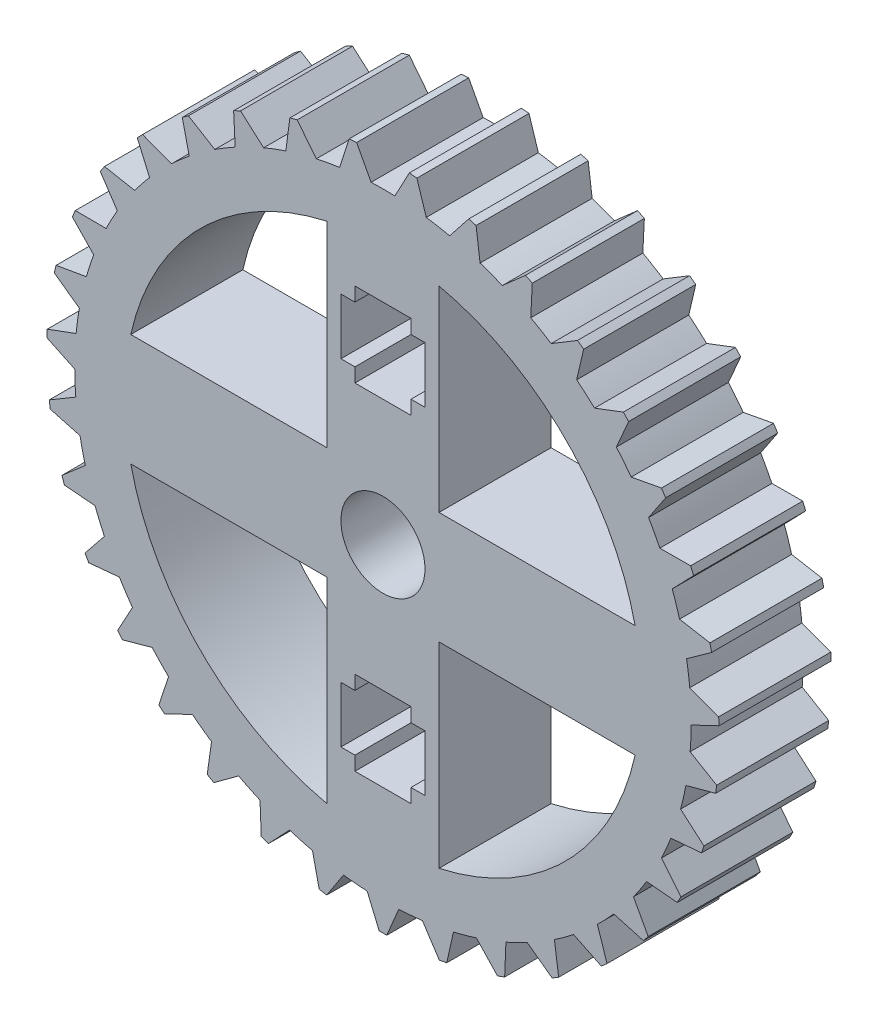
from build123d import *

# Parameters (mm, degrees)
SKETCH1_R            = 6
BOSS_EXTRUDE1_DEPTH  = 2
CUT_EXTRUDE1_DEPTH   = 2
MIRROR2_COPY_1_DEPTH = 2
SKETCH3_R            = 0.75
CUT_EXTRUDE5_DEPTH   = 2
CUT_EXTRUDE6_DEPTH   = 2
CUT_EXTRUDE8_START   = -2
CUT_EXTRUDE8_DEPTH   = 2
CIRPATTERN2_COUNT    = 35


with BuildPart() as part:
    # Sketch1 → Boss-Extrude1 (new body)
    with BuildSketch(Plane.XY):
        Circle(SKETCH1_R)
    extrude(amount=BOSS_EXTRUDE1_DEPTH)

    # Sketch2 → Cut-Extrude1 (cut)
    with BuildSketch(Plane.XY.offset(2)):
        with BuildLine():
            Line((-1, 1), (-4.5, 1))
            ThreePointArc((-4.5, 1), (-3.259601203, 3.259601203), (-1, 4.5))
            Line((-1, 4.5), (-1, 1))
        make_face()
    cut_extrude1 = extrude(amount=-CUT_EXTRUDE1_DEPTH, mode=Mode.SUBTRACT)

    # Mirror1: Cut-Extrude1 across plane
    add(cut_extrude1.mirror(Plane(origin=(0, 0, 0), x_dir=(0, 0, 1), z_dir=(1, 0, 0))), mode=Mode.SUBTRACT)

    # Mirror2: Cut-Extrude1 across plane
    add(cut_extrude1.mirror(Plane.ZX), mode=Mode.SUBTRACT)

    # Mirror2 copy 1 sketch → Mirror2 copy 1 (cut)
    with BuildSketch(Plane(origin=(0, 0, 2), x_dir=(-1, 0, 0), z_dir=(0, 0, 1))):
        with BuildLine():
            Line((-1, 1), (-4.5, 1))
            ThreePointArc((-4.5, 1), (-3.259601203, 3.259601203), (-1, 4.5))
            Line((-1, 4.5), (-1, 1))
        make_face()
    extrude(amount=-MIRROR2_COPY_1_DEPTH, mode=Mode.SUBTRACT)

    # Sketch3 → Cut-Extrude5 (cut)
    with BuildSketch(Plane.XY.offset(2)):
        Circle(SKETCH3_R)
    extrude(amount=-CUT_EXTRUDE5_DEPTH, mode=Mode.SUBTRACT)

    # Sketch4 → Cut-Extrude6 (cut)
    with BuildSketch(Plane.XY.offset(2)):
        Polygon((-0.5, 2.25), (0.5, 2.25), (0.5, 2.5), (0.75, 2.5), (0.75, 3.5), (0.5, 3.5), (0.5, 3.75), (-0.5, 3.75), (-0.5, 3.5), (-0.75, 3.5), (-0.75, 2.5), (-0.5, 2.5), align=None)
    cut_extrude6 = extrude(amount=-CUT_EXTRUDE6_DEPTH, mode=Mode.SUBTRACT)

    # Mirror3: Cut-Extrude6 across plane
    add(cut_extrude6.mirror(Plane.ZX), mode=Mode.SUBTRACT)

    # Sketch6 → Cut-Extrude8 (cut)
    with BuildSketch(Plane.XY.offset(2).offset(CUT_EXTRUDE8_START)):
        with BuildLine():
            ThreePointArc((-0.211779475, 5.495921165), (-0.105909375, 5.498980197), (0, 5.5))
            Line((0, 5.5), (0, 6))
            ThreePointArc((0, 6), (-0.235180734, 5.995389063), (-0.47, 5.981563341))
            Line((-0.47, 5.981563341), (-0.211779475, 5.495921165))
        make_face()
        with BuildLine():
            Line((0, 6), (0, 5.5))
            ThreePointArc((0, 5.5), (0.105909375, 5.498980197), (0.211779475, 5.495921165))
            Line((0.211779475, 5.495921165), (0.47, 5.981563341))
            ThreePointArc((0.47, 5.981563341), (0.235180734, 5.995389063), (0, 6))
        make_face()
    cut_extrude8 = extrude(amount=CUT_EXTRUDE8_DEPTH, mode=Mode.SUBTRACT)

    # CirPattern2: Cut-Extrude8 ×35 about axis
    cirpattern2_axis = Axis((0, 0, 0), (0, 0, 1))
    for i in range(1, CIRPATTERN2_COUNT):
        add(cut_extrude8.rotate(cirpattern2_axis, i * 360 / CIRPATTERN2_COUNT), mode=Mode.SUBTRACT)


solid = part.part
